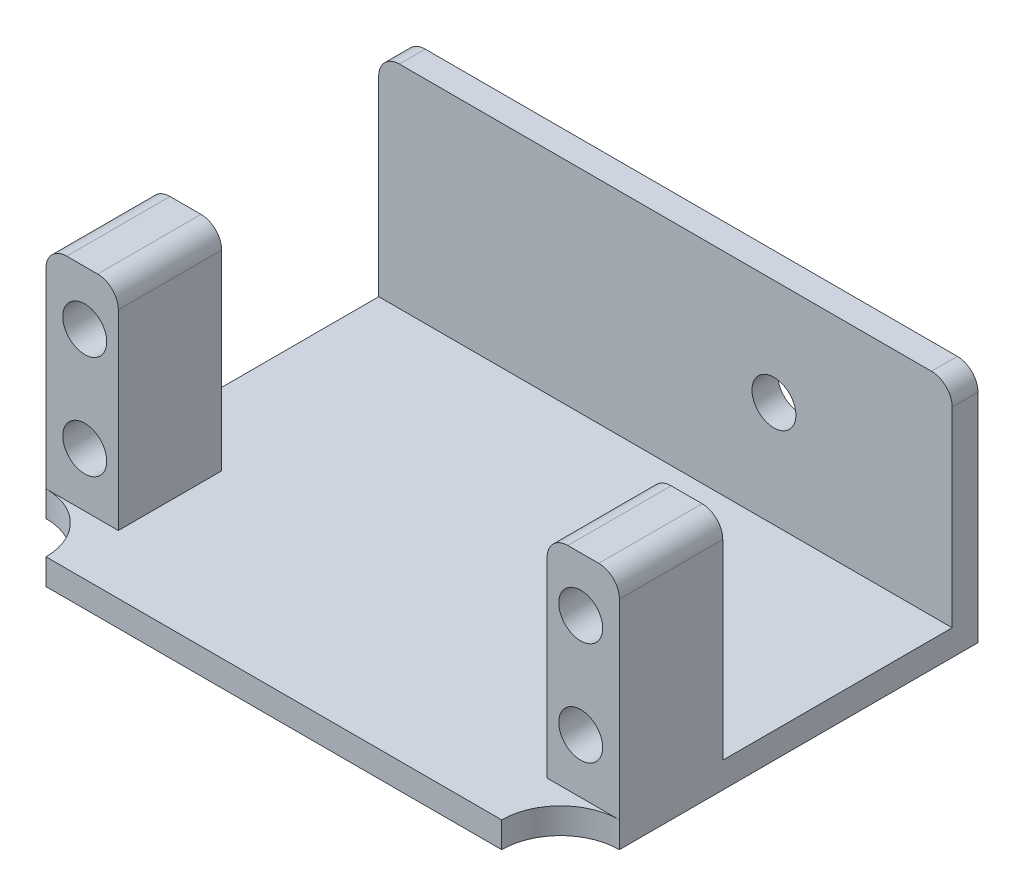
from build123d import *

# Parameters (mm, degrees)
SKETCH1_W                   = 55.5
SKETCH1_H                   = 37.9
BRACKETBASE_DEPTH           = 2.5
SKETCH2_W                   = 7
SKETCH2_H                   = 20.5
SERVOMOUNTINGHOLETABS_DEPTH = 2.5
SKETCH3_R                   = 2.125
SERVOMOUNTINGHOLES_DEPTH    = 2.5
SKETCH4_W                   = 55.5
SKETCH4_H                   = 2.5
BASEWALL_DEPTH              = 23
SKETCH6_R                   = 5.7
BASETRIM_DEPTH              = 2.5
FILLET1_R                   = 2
SKETCH7_R                   = 2.125
M4MOUNTINGHOLE_DEPTH        = 10
SKETCH8_R                   = 2.125
CUT_EXTRUDE1_DEPTH          = 10
SKETCH9_R                   = 2.125
BOSS_EXTRUDE1_DEPTH         = 2.5
SKETCH10_R                  = 2.125
BOSS_EXTRUDE2_DEPTH         = 7.5


with BuildPart() as part:
    # Sketch1 → bracketBase (new body)
    with BuildSketch(Plane(origin=(0, 0, 0), x_dir=(1, 0, 0), z_dir=(0, 1, 0))):
        with Locations((27.75, 18.95)):
            Rectangle(SKETCH1_W, SKETCH1_H)
    extrude(amount=BRACKETBASE_DEPTH)

    # Sketch2 → servoMountingHoleTabs (add)
    with BuildSketch(Plane.XY.offset(-8.2)):
        with Locations((3.5, 12.75)):
            Rectangle(SKETCH2_W, SKETCH2_H)
        with Locations((52, 12.75)):
            Rectangle(SKETCH2_W, SKETCH2_H)
    extrude(amount=SERVOMOUNTINGHOLETABS_DEPTH)

    # Sketch3 → servoMountingHoles (cut)
    with BuildSketch(Plane.XY.offset(-5.7)):
        with Locations((3.75, 17.75)):
            Circle(SKETCH3_R)
        with Locations(Location((3.75, 7.75, 0), (0, 0, 180))):
            Circle(SKETCH3_R)
        with Locations((51.75, 7.75)):
            Circle(SKETCH3_R)
        with Locations(Location((51.75, 17.75, 0), (0, 0, 180))):
            Circle(SKETCH3_R)
    extrude(amount=-SERVOMOUNTINGHOLES_DEPTH, mode=Mode.SUBTRACT)

    # Sketch4 → baseWall (add)
    with BuildSketch(Plane(origin=(0, 0, 0), x_dir=(1, 0, 0), z_dir=(0, 1, 0))):
        with Locations((27.75, 39.15)):
            Rectangle(SKETCH4_W, SKETCH4_H)
    extrude(amount=BASEWALL_DEPTH)

    # Sketch6 → baseTrim (cut)
    with BuildSketch(Plane(origin=(0, 2.5, 0), x_dir=(1, 0, 0), z_dir=(0, 1, 0))):
        Circle(SKETCH6_R)
        with Locations((55.5, 0)):
            Circle(SKETCH6_R)
    extrude(amount=-BASETRIM_DEPTH, mode=Mode.SUBTRACT)

    # Fillet1
    fillet1_edges = [part.edges().sort_by_distance(p)[0] for p in [
        (0, 23, -6.95),
        (7, 23, -6.95),
        (55.5, 23, -6.95),
        (48.5, 23, -6.95),
        (55.5, 23, -39.15),
        (0, 23, -39.15),
    ]]
    fillet(fillet1_edges, radius=FILLET1_R)

    # Sketch7 → M4mountingHole (cut)
    with BuildSketch(Plane(origin=(0, 0, -40.4), x_dir=(-1, 0, 0), z_dir=(0, 0, -1))):
        with Locations((-17.25, 12.75)):
            Circle(SKETCH7_R)
    extrude(amount=-M4MOUNTINGHOLE_DEPTH, mode=Mode.SUBTRACT)

    # Sketch8 → Cut-Extrude1 (cut)
    with BuildSketch(Plane(origin=(0, 0, -40.4), x_dir=(-1, 0, 0), z_dir=(0, 0, -1))):
        with Locations((-38.25, 12.75)):
            Circle(SKETCH8_R)
    extrude(amount=-CUT_EXTRUDE1_DEPTH, mode=Mode.SUBTRACT)

    # Sketch9 → Boss-Extrude1 (add)
    with BuildSketch(Plane(origin=(0, 0, -40.4), x_dir=(-1, 0, 0), z_dir=(0, 0, -1))):
        with Locations((-17.25, 12.75)):
            Circle(SKETCH9_R)
    extrude(amount=-BOSS_EXTRUDE1_DEPTH)

    # Sketch10 → Boss-Extrude2 (add)
    # profile 1 of 2: a face of its own
    with BuildSketch(Plane(origin=(0, 0, -8.2), x_dir=(-1, 0, 0), z_dir=(0, 0, -1))):
        with BuildLine():
            Line((-48.5, 2.5), (-48.5, 21))
            ThreePointArc((-48.5, 21), (-49.085786438, 22.414213562), (-50.5, 23))
            Line((-50.5, 23), (-53.5, 23))
            ThreePointArc((-53.5, 23), (-54.914213562, 22.414213562), (-55.5, 21))
            Line((-55.5, 21), (-55.5, 2.5))
            Line((-55.5, 2.5), (-48.5, 2.5))
        make_face()
        with Locations((-51.75, 17.75)):
            Circle(SKETCH10_R, mode=Mode.SUBTRACT)
        with Locations(Location((-51.75, 7.75, 0), (0, 0, 180))):
            Circle(SKETCH10_R, mode=Mode.SUBTRACT)
    # profile 2 of 2: a face of its own
    with BuildSketch(Plane(origin=(0, 0, -8.2), x_dir=(-1, 0, 0), z_dir=(0, 0, -1))):
        with BuildLine():
            Line((-2, 23), (-5, 23))
            ThreePointArc((-5, 23), (-6.414213562, 22.414213562), (-7, 21))
            Line((-7, 21), (-7, 2.5))
            Line((-7, 2.5), (0, 2.5))
            Line((0, 2.5), (0, 21))
            ThreePointArc((0, 21), (-0.585786438, 22.414213562), (-2, 23))
        make_face()
        with Locations(Location((-3.75, 17.75, 0), (0, 0, 180))):
            Circle(SKETCH10_R, mode=Mode.SUBTRACT)
        with Locations((-3.75, 7.75)):
            Circle(SKETCH10_R, mode=Mode.SUBTRACT)
    extrude(amount=BOSS_EXTRUDE2_DEPTH)


solid = part.part
